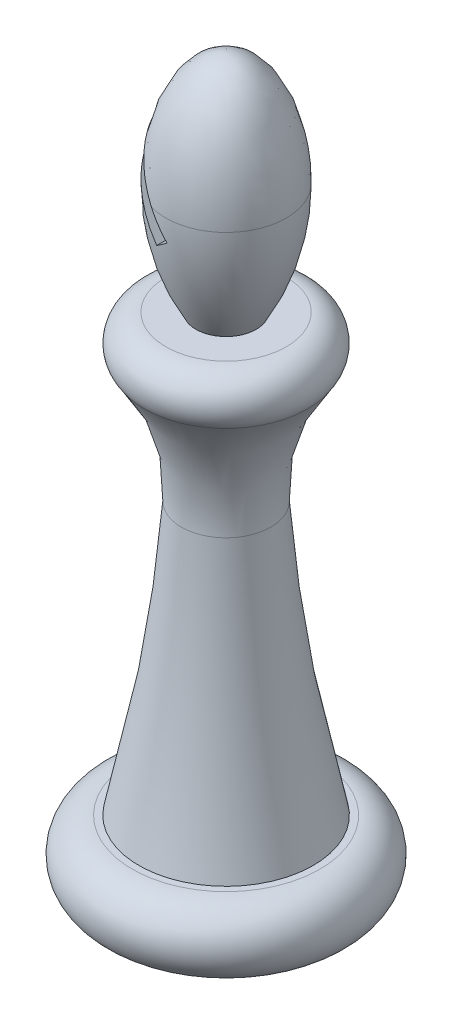
from build123d import *

# Parameters (mm, degrees)
CUT_EXTRUDE1_DEPTH = 5
FILLET1_R          = 10


with BuildPart() as part:
    # Sketch1 → Revolve1 (revolve)
    with BuildSketch(Plane.XY, mode=Mode.PRIVATE) as revolve1_sk:
        with BuildLine():
            Line((0, 40.458532682), (0, -0.569692833))
            Line((0, -0.569692833), (5.298787688, -0.569692833))
            ThreePointArc((5.298787688, -0.569692833), (7.198383147, 1.329902625), (5.298787688, 3.229498084))
            Line((5.298787688, 3.229498084), (4.930029563, 3.229498084))
            ThreePointArc((4.930029563, 3.229498084), (2.967910215, 13.948498921), (2.310682836, 24.8257662))
            Line((2.310682836, 24.8257662), (3.405196965, 24.8257662))
            ThreePointArc((3.405196965, 24.8257662), (4.921249174, 26.341818409), (3.405196965, 27.857870618))
            Line((3.405196965, 27.857870618), (1.702598482, 27.857870618))
            ThreePointArc((1.702598482, 27.857870618), (2.97204755, 30.895035523), (3.405196965, 34.15820165))
            add(Edge.make_bspline(
                [(3.405196965, 34.15820165), (3.405196965, 40.458532682), (0, 40.458532682)],
                knots=[1.570796327, 1.570796327, 1.570796327, 3.141592654, 3.141592654, 3.141592654], degree=2, weights=[1, 0.707106781, 1]))
        make_face()
    revolve(revolve1_sk.sketch.rotate(Axis((0, -0.569692833, 0), (0, 1, 0)), 90), axis=Axis((0, -0.569692833, 0), (0, 1, 0)))

    # Sketch2 → Cut-Extrude1 (cut, symmetric)
    with BuildSketch(Plane.XY):
        Polygon((-3.063184817, 36.910146459), (0, 32.903814436), (-0.73357176, 32.342935841), (-3.301459715, 35.701470295), (-4.965060611, 35.985405562), (-4.040319714, 37.887281356), align=None)
    extrude(amount=CUT_EXTRUDE1_DEPTH, both=True, mode=Mode.SUBTRACT)

    # Fillet1
    fillet1_edges = [part.edges().sort_by_distance(p)[0] for p in [
        (0, 24.8257662, 2.310682836),
    ]]
    fillet(fillet1_edges, radius=FILLET1_R)


solid = part.part
